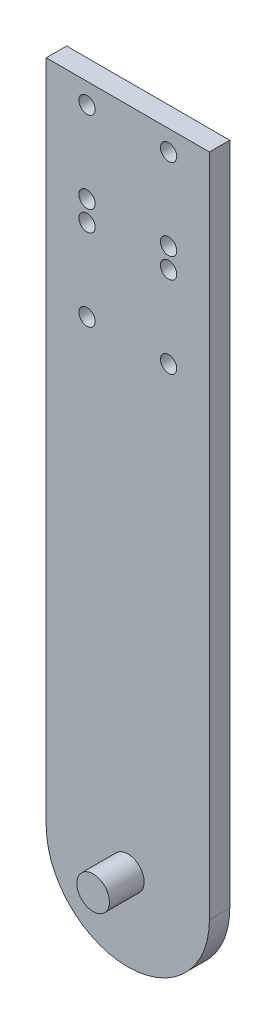
from build123d import *

# Parameters (mm, degrees)
BOSS_EXTRUDE1_DEPTH = 5
SKETCH2_R           = 4
BOSS_EXTRUDE2_DEPTH = 8.5
SKETCH3_R           = 2
CUT_EXTRUDE1_DEPTH  = 50
SKETCH5_R           = 2
CUT_EXTRUDE2_DEPTH  = 50
LPATTERN1_COUNT     = 2
LPATTERN1_PITCH     = 20


with BuildPart() as part:
    # Sketch1 → Boss-Extrude1 (new body)
    with BuildSketch(Plane.XY):
        with BuildLine():
            Line((-40, 163), (0, 163))
            Line((0, 163), (0, 0))
            ThreePointArc((0, 0), (-20, -20), (-40, 0))
            Line((-40, 0), (-40, 163))
        make_face()
    extrude(amount=BOSS_EXTRUDE1_DEPTH)

    # Sketch2 → Boss-Extrude2 (add)
    with BuildSketch(Plane.XY.offset(5)):
        with Locations((-20, 0)):
            Circle(SKETCH2_R)
    extrude(amount=BOSS_EXTRUDE2_DEPTH)

    # Sketch3 → Cut-Extrude1 (cut)
    with BuildSketch(Plane.XY.offset(5)):
        with Locations((-30, 158)):
            Circle(SKETCH3_R)
        with Locations((-10, 158)):
            Circle(SKETCH3_R)
    cut_extrude1 = extrude(amount=-CUT_EXTRUDE1_DEPTH, mode=Mode.SUBTRACT)

    # Sketch5 → Cut-Extrude2 (cut)
    with BuildSketch(Plane.XY.offset(5)):
        with Locations((-30, 133)):
            Circle(SKETCH5_R)
        with Locations((-10, 133)):
            Circle(SKETCH5_R)
    cut_extrude2 = extrude(amount=-CUT_EXTRUDE2_DEPTH, mode=Mode.SUBTRACT)

    # LPattern1: Cut-Extrude1, Cut-Extrude2 ×2
    with Locations(*[(0, -i * LPATTERN1_PITCH, 0) for i in range(1, LPATTERN1_COUNT)]):
        add(cut_extrude1, mode=Mode.SUBTRACT)
        add(cut_extrude2, mode=Mode.SUBTRACT)


solid = part.part
